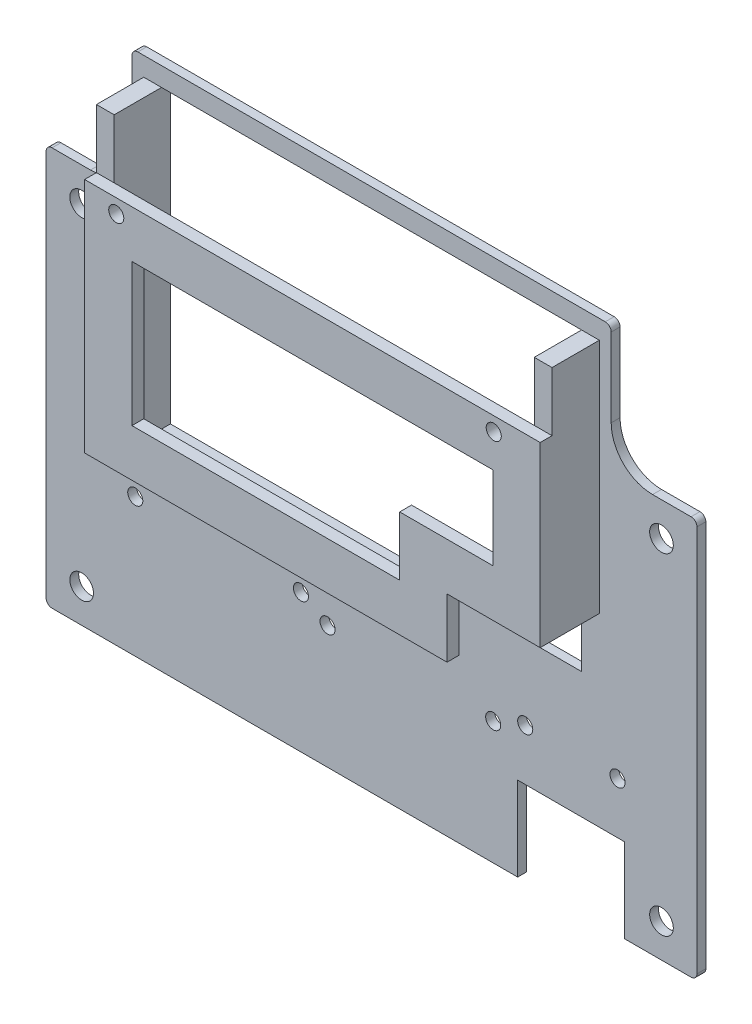
from build123d import *

# Parameters (mm, degrees)
SKETCH_1_R           = 2
EXTRUDE_1_DEPTH      = 1.5
SKETCH_2_W           = 3
SKETCH_2_H           = 50
SKETCH_2_H_2         = 40
EXTRUDE_3_DEPTH      = 8
EXTRUDE_4_DEPTH      = 2
SKETCH_4_W           = 71.000000198
SKETCH_4_H           = 50
CUT_EXTRUDE_1_DEPTH  = 128.300477144
CUT_EXTRUDE_3_DEPTH  = 128.427082997
SKETCH_11_W          = 18.075
SKETCH_11_H          = 14.197672296
CUT_EXTRUDE_4_DEPTH  = 128.300477144
HOLE_WIZARD_M2_5_1_D = 2.55


with BuildPart() as part:
    # 草圖1 → 填料-伸長1 (new body)
    with BuildSketch(Plane.XY):
        with BuildLine():
            Line((-78.58357781, -93.341907955), (16.519190028, -93.341907955))
            Line((16.519190028, -93.341907955), (23.019189929, -93.341907955))
            ThreePointArc((23.019189929, -93.341907955), (23.72629671, -93.049014736), (24.019189929, -92.341907955))
            Line((24.019189929, -92.341907955), (24.019189929, -26.916101175))
            ThreePointArc((24.019189929, -26.916101175), (23.715868617, -26.228364762), (23.019189929, -25.946187519))
            Line((23.019189929, -25.946187519), (16.519190028, -25.946187519))
            ThreePointArc((16.519190028, -25.946187519), (11.569442559, -23.895934988), (9.519190028, -18.946187519))
            Line((9.519190028, -18.946187519), (9.519190028, -5.659090909))
            ThreePointArc((9.519190028, -5.659090909), (9.226296809, -4.951984128), (8.519190028, -4.659090909))
            Line((8.519190028, -4.659090909), (-70.48081017, -4.659090909))
            ThreePointArc((-70.48081017, -4.659090909), (-71.187916951, -4.951984128), (-71.48081017, -5.659090909))
            Line((-71.48081017, -5.659090909), (-71.48081017, -18.946187519))
            ThreePointArc((-71.48081017, -18.946187519), (-73.531062702, -23.895934988), (-78.48081017, -25.946187519))
            Line((-78.48081017, -25.946187519), (-84.980810071, -25.946187519))
            ThreePointArc((-84.980810071, -25.946187519), (-85.687916853, -26.239080738), (-85.980810071, -26.946187519))
            Line((-85.980810071, -26.946187519), (-85.980810071, -92.341911374))
            ThreePointArc((-85.980810071, -92.341911374), (-85.688840793, -93.048093006), (-84.983425077, -93.341907955))
            Line((-84.983425077, -93.341907955), (-78.58357781, -93.341907955))
        make_face()
        with Locations((-79.980810071, -31.644049447)):
            Circle(SKETCH_1_R, mode=Mode.SUBTRACT)
        with Locations((18.019189929, -31.644049447)):
            Circle(SKETCH_1_R, mode=Mode.SUBTRACT)
        with Locations((18.019189929, -87.644049447)):
            Circle(SKETCH_1_R, mode=Mode.SUBTRACT)
        with Locations((-79.980810071, -87.644049447)):
            Circle(SKETCH_1_R, mode=Mode.SUBTRACT)
    extrude(amount=EXTRUDE_1_DEPTH)

    # 草圖2 → 填料-伸長3 (add)
    with BuildSketch(Plane.XY.offset(1.5)):
        with Locations((-67.98081017, -32.85713984)):
            Rectangle(SKETCH_2_W, SKETCH_2_H)
        with Locations((6.019190028, -27.85713984)):
            Rectangle(SKETCH_2_W, SKETCH_2_H_2)
    extrude(amount=EXTRUDE_3_DEPTH)

    # 草圖3 → 填料-伸長4 (add)
    with BuildSketch(Plane.XY.offset(9.5)):
        Polygon((-69.48081017, -17.828011501), (7.519190028, -17.828011501), (7.519190028, -47.85713984), (-8.225095928, -47.85713984), (-8.225095928, -57.85713984), (-69.48081017, -57.85713984), align=None)
    extrude(amount=EXTRUDE_4_DEPTH)

    # 草圖4 → 除料-伸長1 (cut, through all)
    with BuildSketch(Plane.XY.offset(1.5)):
        with Locations((-30.980810071, -32.85713984)):
            Rectangle(SKETCH_4_W, SKETCH_4_H)
    extrude(amount=-CUT_EXTRUDE_1_DEPTH, mode=Mode.SUBTRACT)

    # 草圖7 → 除料-伸長3 (cut, through all)
    with BuildSketch(Plane.XY.offset(11.5)):
        Polygon((-16.225095928, -49.85713984), (-16.225095928, -39.85713984), (-0.480809972, -39.85713984), (-0.480809972, -25.828011501), (-61.48081017, -25.828011501), (-61.48081017, -49.85713984), align=None)
    extrude(amount=-CUT_EXTRUDE_3_DEPTH, mode=Mode.SUBTRACT)

    # 草圖11 → 除料-伸長4 (cut, through all)
    with BuildSketch(Plane.XY.offset(1.5)):
        with Locations((2.751904461, -86.243071807)):
            Rectangle(SKETCH_11_W, SKETCH_11_H)
    extrude(amount=-CUT_EXTRUDE_4_DEPTH, mode=Mode.SUBTRACT)

    # M2.5 螺旋的螺孔鑽1 (through all)
    with Locations(Plane(origin=(0, 0, 0), x_dir=(1, 0, 0), z_dir=(0, 0, -1))):
        with Locations((-64.13081017, 20.20713984), (-0.33081017, 20.20713984), (10.589404461, 70.471994299), (-5.010595539, 70.471994299), (-10.419668394, 72.571170345), (-38.419668394, 72.571170345), (-42.919668394, 69.961668418), (-70.919668394, 69.961668418)):
            Hole(HOLE_WIZARD_M2_5_1_D / 2)


solid = part.part
